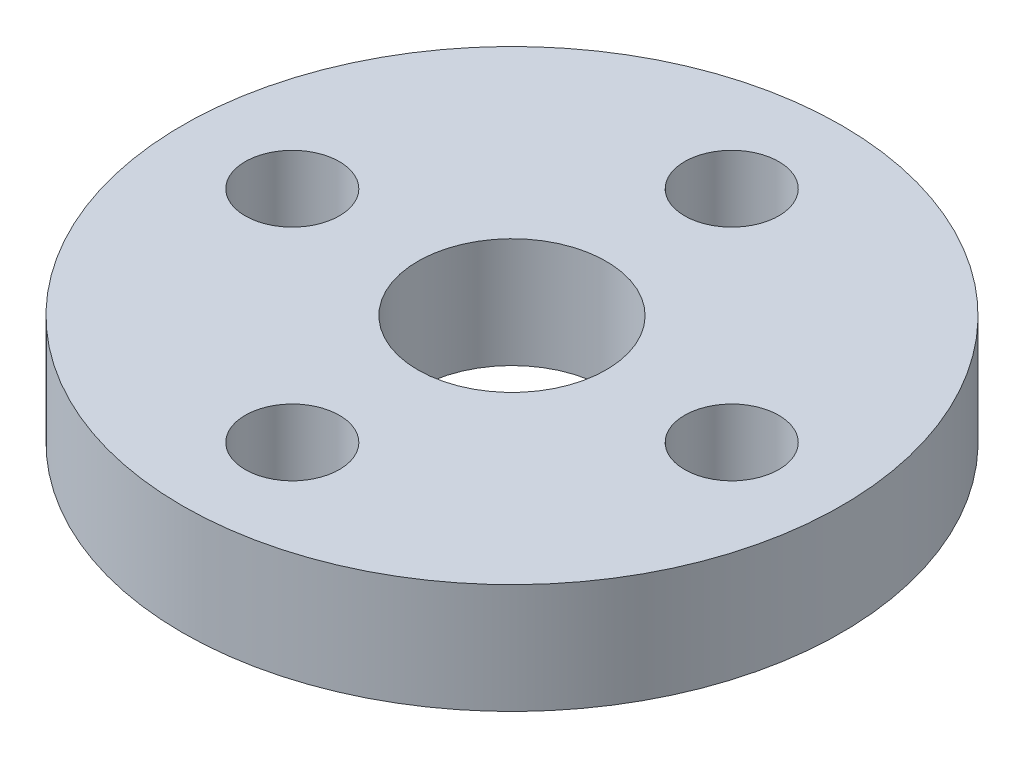
from build123d import *

# Parameters (mm, degrees)
SKETCH1_R           = 10.5
BOSS_EXTRUDE1_DEPTH = 3.5
SKETCH2_R           = 3
SKETCH2_R_2         = 1.5
CUT_EXTRUDE1_DEPTH  = 10.2


with BuildPart() as part:
    # Sketch1 → Boss-Extrude1 (new body)
    with BuildSketch(Plane(origin=(0, 0, 0), x_dir=(1, 0, 0), z_dir=(0, 1, 0))):
        with Locations(Location((0, 0, 0), (0, 0, 90))):
            Circle(SKETCH1_R)
    extrude(amount=BOSS_EXTRUDE1_DEPTH)

    # Sketch2 → Cut-Extrude1 (cut)
    with BuildSketch(Plane(origin=(0, 3.5, 0), x_dir=(1, 0, 0), z_dir=(0, 1, 0))):
        with Locations(Location((0, 0, 0), (0, 0, 270))):
            Circle(SKETCH2_R)
        with Locations(Location((0, 7, 0), (0, 0, 270))):
            Circle(SKETCH2_R_2)
        with Locations(Location((7, 0, 0), (0, 0, 270))):
            Circle(SKETCH2_R_2)
        with Locations(Location((0, -7, 0), (0, 0, 270))):
            Circle(SKETCH2_R_2)
        with Locations(Location((-7, 0, 0), (0, 0, 270))):
            Circle(SKETCH2_R_2)
    extrude(amount=-CUT_EXTRUDE1_DEPTH, mode=Mode.SUBTRACT)


solid = part.part
